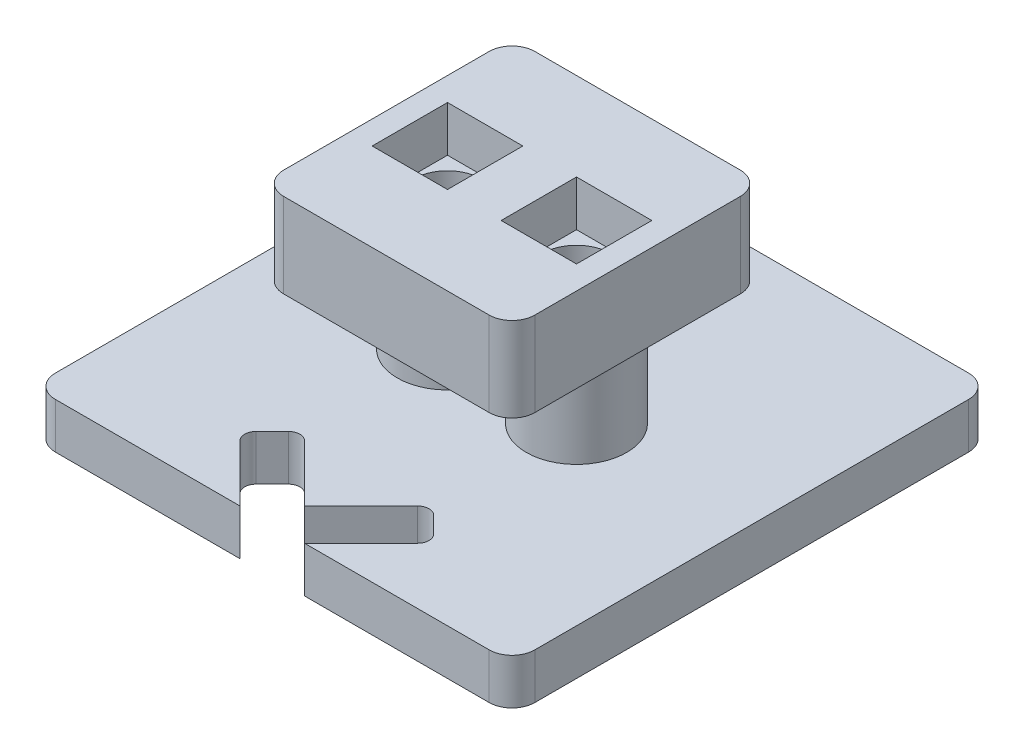
from build123d import *

# Parameters (mm, degrees)
SKETCH1_W           = 11
SKETCH1_H           = 11
BOSS_EXTRUDE1_DEPTH = 3.7
FILLET1_R           = 1
SKETCH2_W           = 3.3
SKETCH2_H           = 3.3
CUT_EXTRUDE1_DEPTH  = 2
SKETCH4_R           = 2.2
BOSS_EXTRUDE2_DEPTH = 6
BOSS_EXTRUDE3_DEPTH = 2
SKETCH3_R           = 1.5
CUT_EXTRUDE2_DEPTH  = 18.736685147
CUT_EXTRUDE3_DEPTH  = 17.726924403


with BuildPart() as part:
    # Sketch1 → Boss-Extrude1 (new body)
    with BuildSketch(Plane(origin=(0, 0, 0), x_dir=(1, 0, 0), z_dir=(0, 1, 0))):
        Rectangle(SKETCH1_W, SKETCH1_H)
    extrude(amount=BOSS_EXTRUDE1_DEPTH)

    # Fillet1
    fillet1_edges = [part.edges().sort_by_distance(p)[0] for p in [
        (5.5, 1.85, 5.5),
        (-5.5, 1.85, 5.5),
        (-5.5, 1.85, -5.5),
        (5.5, 1.85, -5.5),
    ]]
    fillet(fillet1_edges, radius=FILLET1_R)

    # Sketch2 → Cut-Extrude1 (cut)
    with BuildSketch(Plane(origin=(0, 3.7, 0), x_dir=(1, 0, 0), z_dir=(0, 1, 0))):
        with Locations((-2.825, 0)):
            Rectangle(SKETCH2_W, SKETCH2_H)
        with Locations((2.825, 0)):
            Rectangle(SKETCH2_W, SKETCH2_H)
    extrude(amount=-CUT_EXTRUDE1_DEPTH, mode=Mode.SUBTRACT)

    # Sketch4 → Boss-Extrude2 (add)
    with BuildSketch(Plane(origin=(0, 0, 0), x_dir=(-1, 0, 0), z_dir=(0, -1, 0))):
        with Locations(Location((2.825, 0, 0), (0, 0, 90))):
            Circle(SKETCH4_R)
        with Locations(Location((-2.825, 0, 0), (0, 0, 90))):
            Circle(SKETCH4_R)
    extrude(amount=BOSS_EXTRUDE2_DEPTH)

    # Sketch5 → Boss-Extrude3 (add)
    with BuildSketch(Plane(origin=(0, -6, 0), x_dir=(-1, 0, 0), z_dir=(0, -1, 0))):
        with BuildLine():
            Line((9.5, 10.5), (-9.5, 10.5))
            ThreePointArc((-9.5, 10.5), (-10.207106781, 10.207106781), (-10.5, 9.5))
            Line((-10.5, 9.5), (-10.5, -9.5))
            ThreePointArc((-10.5, -9.5), (-10.207106781, -10.207106781), (-9.5, -10.5))
            Line((-9.5, -10.5), (9.5, -10.5))
            ThreePointArc((9.5, -10.5), (10.207106781, -10.207106781), (10.5, -9.5))
            Line((10.5, -9.5), (10.5, 9.5))
            ThreePointArc((10.5, 9.5), (10.207106781, 10.207106781), (9.5, 10.5))
        make_face()
    extrude(amount=-BOSS_EXTRUDE3_DEPTH)

    # Sketch3 → Cut-Extrude2 (cut, through all)
    with BuildSketch(Plane(origin=(0, 3.7, 0), x_dir=(1, 0, 0), z_dir=(0, 1, 0))):
        with Locations(Location((-2.825, 0, 0), (0, 0, 270))):
            Circle(SKETCH3_R)
        with Locations(Location((2.825, 0, 0), (0, 0, 270))):
            Circle(SKETCH3_R)
    extrude(amount=-CUT_EXTRUDE2_DEPTH, mode=Mode.SUBTRACT)

    # Sketch7 → Cut-Extrude3 (cut, through all)
    with BuildSketch(Plane(origin=(0, -4, 0), x_dir=(1, 0, 0), z_dir=(0, 1, 0))):
        with BuildLine():
            Line((0, -9.085786438), (1.414213562, -10.5))
            Line((1.414213562, -10.5), (3.889087297, -8.025126266))
            ThreePointArc((3.889087297, -8.025126266), (4.035533906, -7.671572875), (3.889087297, -7.318019485))
            Line((3.889087297, -7.318019485), (3.181980515, -6.610912703))
            ThreePointArc((3.181980515, -6.610912703), (2.828427125, -6.464466094), (2.474873734, -6.610912703))
            Line((2.474873734, -6.610912703), (0, -9.085786438))
        make_face()
        with BuildLine():
            Line((-3.889087297, -8.025126266), (-1.414213562, -10.5))
            Line((-1.414213562, -10.5), (0, -9.085786438))
            Line((0, -9.085786438), (-2.474873734, -6.610912703))
            ThreePointArc((-2.474873734, -6.610912703), (-2.828427125, -6.464466094), (-3.181980515, -6.610912703))
            Line((-3.181980515, -6.610912703), (-3.889087297, -7.318019485))
            ThreePointArc((-3.889087297, -7.318019485), (-4.035533906, -7.671572875), (-3.889087297, -8.025126266))
        make_face()
        Polygon((-1.414213562, -10.5), (1.414213562, -10.5), (0, -9.085786438), align=None)
    extrude(amount=-CUT_EXTRUDE3_DEPTH, mode=Mode.SUBTRACT)


solid = part.part
